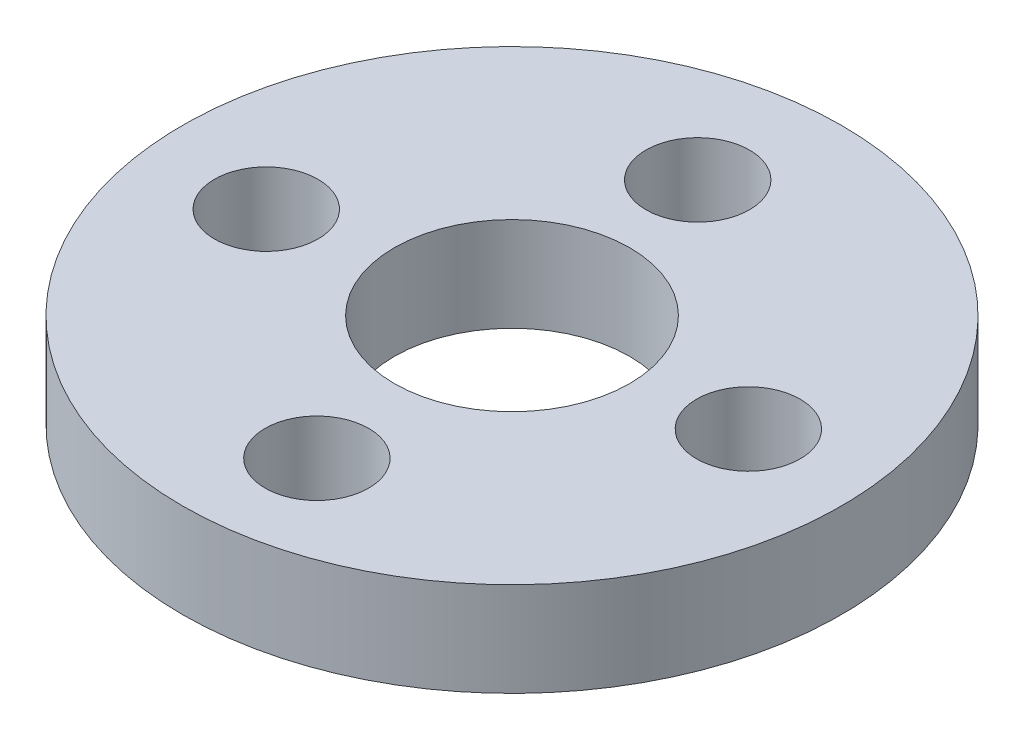
from build123d import *

# Parameters (mm, degrees)
SKETCH_1_R                         = 7
EXTRUDE_1_DEPTH                    = 2
SKETCH_2_R                         = 1.1
CUT_EXTRUDE_1_DEPTH                = 2
PATTERN_CIRCULAR_1_COUNT           = 2
PATTERN_CIRCULAR_1_ANGLE           = 90
PATTERN_CIRCULAR_1_COPY_1_SKETCH_R = 1.1
PATTERN_CIRCULAR_1_COPY_1_DEPTH    = 2
SKETCH_3_R                         = 2.5
CUT_EXTRUDE_2_DEPTH                = 2


with BuildPart() as part:
    # 草图1 → 凸台-拉伸1 (new body)
    with BuildSketch(Plane(origin=(0, 0, 0), x_dir=(1, 0, 0), z_dir=(0, 1, 0))):
        Circle(SKETCH_1_R)
    extrude(amount=EXTRUDE_1_DEPTH)

    # 草图2 → 切除-拉伸1 (cut)
    with BuildSketch(Plane(origin=(0, 2, 0), x_dir=(1, 0, 0), z_dir=(0, 1, 0))):
        with Locations((-0.524681621, 4.469307463)):
            Circle(SKETCH_2_R)
    cut_extrude_1 = extrude(amount=-CUT_EXTRUDE_1_DEPTH, mode=Mode.SUBTRACT)

    # 镜向1: 切除-拉伸1 across plane
    add(cut_extrude_1.mirror(Plane(origin=(0.013284469, 0, 0.113158862), x_dir=(0.9931794361720326, 0, -0.11659591573036844), z_dir=(0.11659591573036844, 0, 0.9931794361720327))), mode=Mode.SUBTRACT)

    # 阵列(圆周)1: 切除-拉伸1 ×2 about axis
    pattern_circular_1_axis = Axis((0.013284469, 7.444722215, 0.113158862), (0, -1, 0))
    for i in range(1, PATTERN_CIRCULAR_1_COUNT):
        add(cut_extrude_1.rotate(pattern_circular_1_axis, i * PATTERN_CIRCULAR_1_ANGLE / (PATTERN_CIRCULAR_1_COUNT - 1)), mode=Mode.SUBTRACT)

    # 阵列(圆周)1 copy 1 sketch → 阵列(圆周)1 copy 1 (cut)
    with BuildSketch(Plane(origin=(-0.099874394, 2, 0.126443331), x_dir=(0.23160133169009495, 0, 0.9728107848699944), z_dir=(0, 1, 0))):
        with Locations((-0.524681621, -4.469307463)):
            Circle(PATTERN_CIRCULAR_1_COPY_1_SKETCH_R)
    extrude(amount=-PATTERN_CIRCULAR_1_COPY_1_DEPTH, mode=Mode.SUBTRACT)

    # 草图3 → 切除-拉伸2 (cut)
    with BuildSketch(Plane(origin=(0, 2, 0), x_dir=(1, 0, 0), z_dir=(0, 1, 0))):
        Circle(SKETCH_3_R)
    extrude(amount=-CUT_EXTRUDE_2_DEPTH, mode=Mode.SUBTRACT)


solid = part.part
